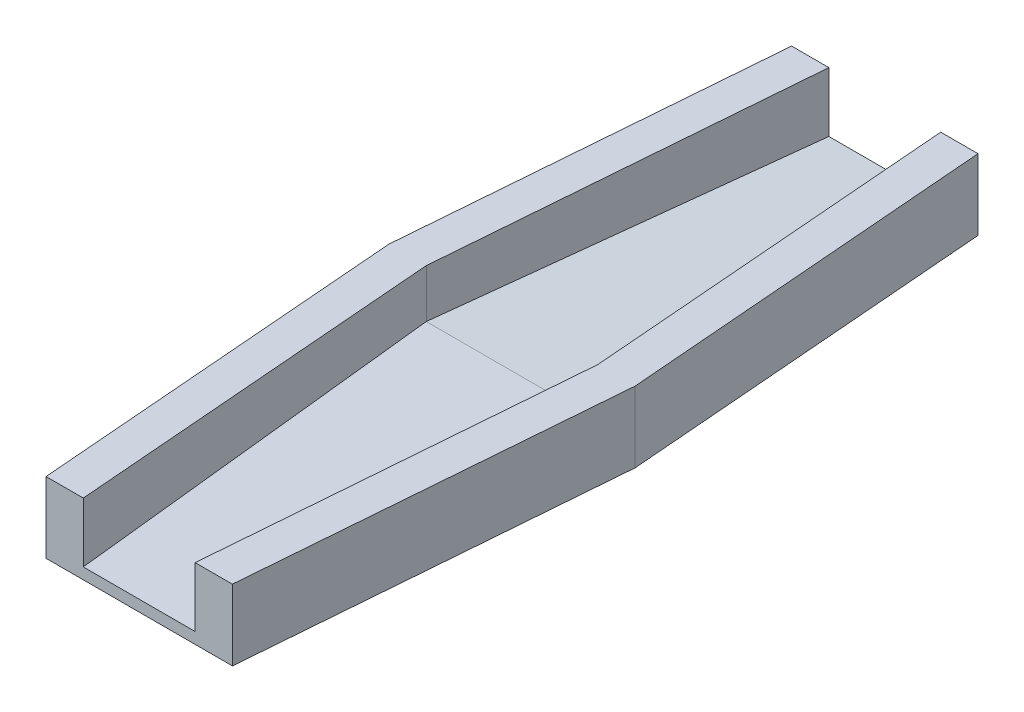
from build123d import *

# Parameters (mm, degrees)
ESBO_O3_W        = 10.701271156
ESBO_O3_H        = 3.779396545
CORTE_MEIO_DEPTH = 80


with BuildPart() as part:
    # Esboço1 → Loft1 section 0
    with BuildSketch(Plane.XY):
        with BuildLine():
            Line((-3.3, -1.9), (3.3, -1.9))
            Line((3.3, -1.9), (3.3, 1.9))
            Line((3.3, 1.9), (-3.3, 1.9))
            Line((-3.3, 1.9), (-3.3, -1.9))
        make_face()
    # Esboço2 → Loft1 section 1
    with BuildSketch(Plane.XY.offset(10)):
        with BuildLine():
            Line((-2.5, -1.9), (2.5, -1.9))
            Line((2.5, -1.9), (2.5, 1.9))
            Line((2.5, 1.9), (-2.5, 1.9))
            Line((-2.5, 1.9), (-2.5, -1.9))
        make_face()
    loft1 = loft()

    # Esboço3 → Corte Meio (cut)
    with BuildSketch(Plane.XY):
        with Locations((0.988815263, 1.889698273)):
            Rectangle(ESBO_O3_W, ESBO_O3_H)
    corte_meio = extrude(amount=CORTE_MEIO_DEPTH, mode=Mode.SUBTRACT)

    # Esboço6 → Loft de corte1 section 0
    with BuildSketch(Plane.XY.offset(10)):
        with BuildLine():
            Line((-1.5, -1.6), (1.5, -1.6))
            Line((1.5, -1.6), (1.5, 1.6))
            Line((1.5, 1.6), (-1.5, 1.6))
            Line((-1.5, 1.6), (-1.5, -1.6))
        make_face()
    # Esboço5 → Loft de corte1 section 1
    with BuildSketch(Plane.XY):
        with BuildLine():
            Line((2.3, -1.3), (-2.3, -1.3))
            Line((-2.3, -1.3), (-2.3, 1.3))
            Line((-2.3, 1.3), (2.3, 1.3))
            Line((2.3, 1.3), (2.3, -1.3))
        make_face()
    loft_de_corte1 = loft(mode=Mode.SUBTRACT)

    # Espelhar1: Loft1 across plane
    add(loft1.mirror(Plane.XY))

    # Espelhar2: Corte Meio across plane
    add(corte_meio.mirror(Plane.XY), mode=Mode.SUBTRACT)

    # Espelhar3: Loft de corte1 across plane
    add(loft_de_corte1.mirror(Plane.XY), mode=Mode.SUBTRACT)


solid = part.part
